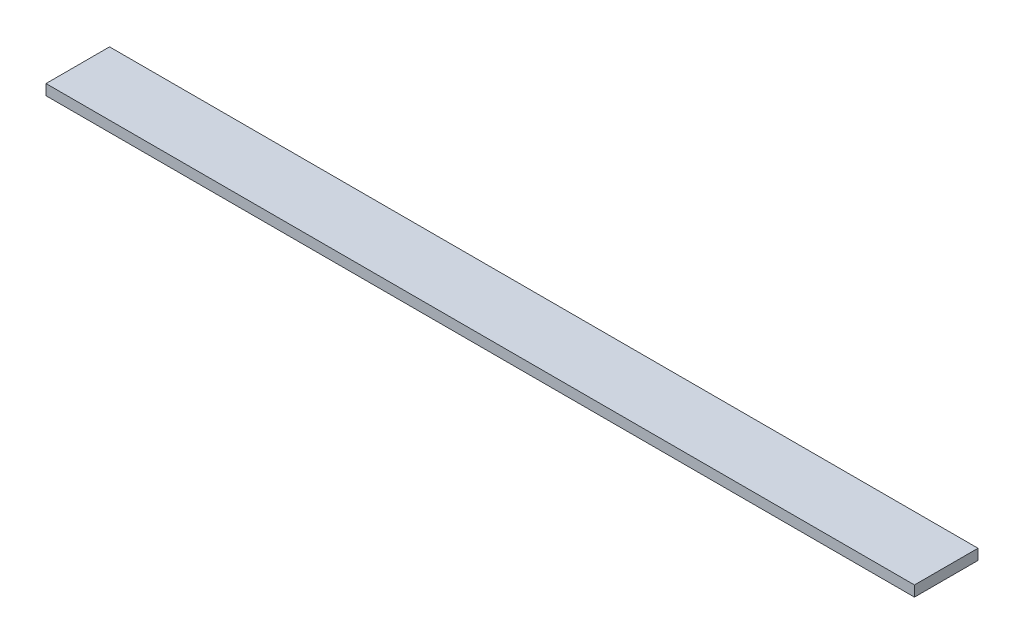
from build123d import *

# Parameters (mm, degrees)
SKETCH1_W           = 260.35
SKETCH1_H           = 19.05
BOSS_EXTRUDE1_DEPTH = 3.175


with BuildPart() as part:
    # Sketch1 → Boss-Extrude1 (new body)
    with BuildSketch(Plane(origin=(0, 0, 0), x_dir=(1, 0, 0), z_dir=(0, 1, 0))):
        with Locations((130.175, 9.525)):
            Rectangle(SKETCH1_W, SKETCH1_H)
    extrude(amount=BOSS_EXTRUDE1_DEPTH)


solid = part.part
